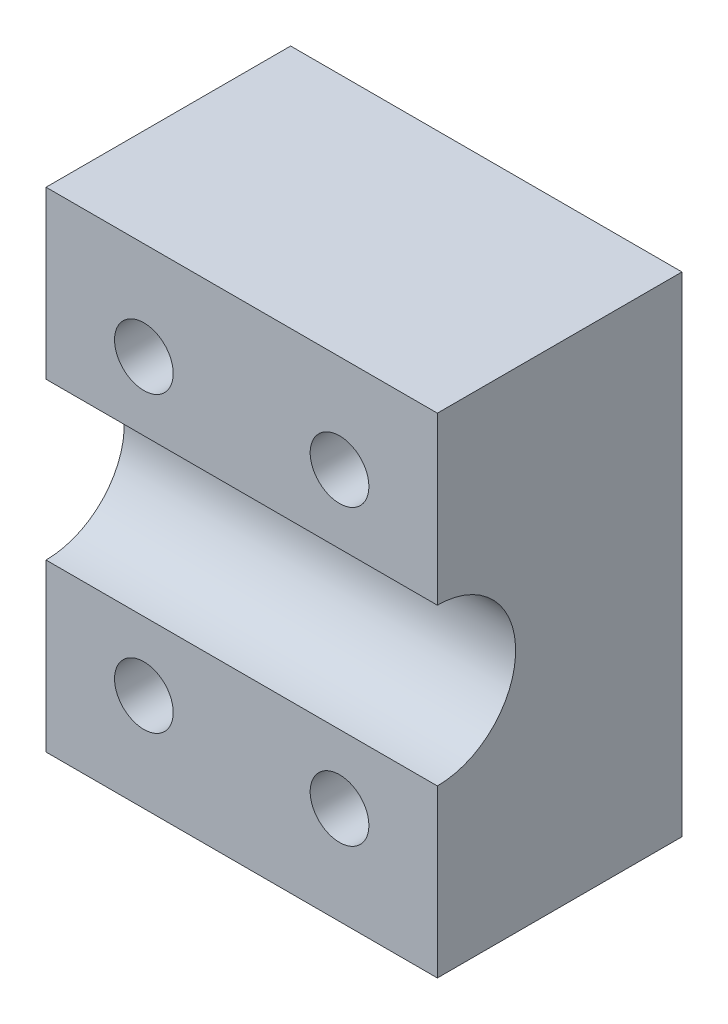
from build123d import *

# Parameters (mm, degrees)
SKETCH1_W           = 40
SKETCH1_H           = 50
BOSS_EXTRUDE1_DEPTH = 25
SKETCH2_R           = 8
CUT_EXTRUDE1_DEPTH  = 58
SKETCH3_R           = 3
CUT_EXTRUDE2_DEPTH  = 25


with BuildPart() as part:
    # Sketch1 → Boss-Extrude1 (new body)
    with BuildSketch(Plane.XY):
        with Locations((20, 25)):
            Rectangle(SKETCH1_W, SKETCH1_H)
    extrude(amount=BOSS_EXTRUDE1_DEPTH)

    # Sketch2 → Cut-Extrude1 (cut)
    with BuildSketch(Plane.ZY):
        with Locations((25, 25)):
            Circle(SKETCH2_R)
    extrude(amount=-CUT_EXTRUDE1_DEPTH, mode=Mode.SUBTRACT)

    # Sketch3 → Cut-Extrude2 (cut)
    with BuildSketch(Plane.XY.offset(25)):
        with Locations((10, 40)):
            Circle(SKETCH3_R)
        with Locations((30, 40)):
            Circle(SKETCH3_R)
        with Locations((30, 10)):
            Circle(SKETCH3_R)
        with Locations((10, 10)):
            Circle(SKETCH3_R)
    extrude(amount=-CUT_EXTRUDE2_DEPTH, mode=Mode.SUBTRACT)


solid = part.part
